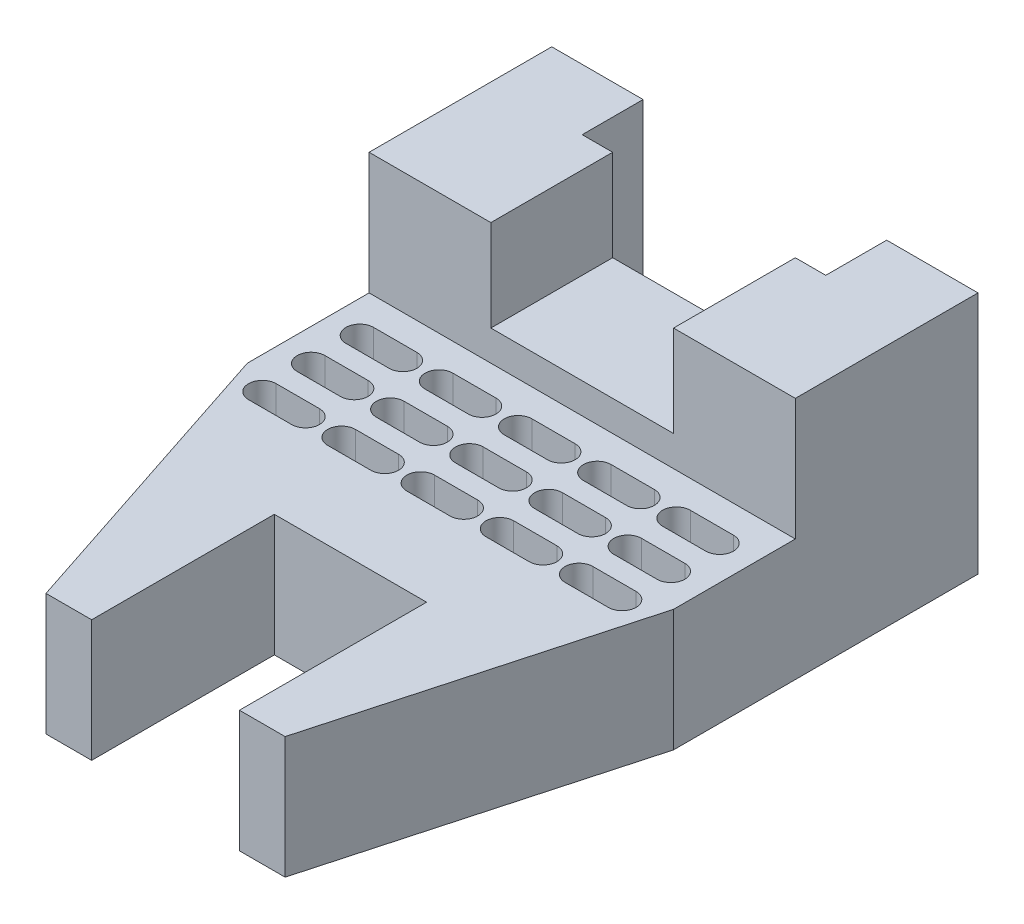
from build123d import *

# Parameters (mm, degrees)
SKETCH2_W           = 70
SKETCH2_H           = 40
BOSS_EXTRUDE1_DEPTH = 50
SKETCH3_W           = 40
SKETCH3_H           = 10
CUT_EXTRUDE1_DEPTH  = 40
SKETCH4_W           = 30
SKETCH4_H           = 40
CUT_EXTRUDE2_DEPTH  = 15
SKETCH5_W           = 70
SKETCH5_H           = 20
CUT_EXTRUDE3_DEPTH  = 20
BOSS_EXTRUDE2_DEPTH = 20
CUT_EXTRUDE4_DEPTH  = 124.693168769


with BuildPart() as part:
    # Sketch2 → Boss-Extrude1 (new body)
    with BuildSketch(Plane.XY):
        with Locations((35, 20)):
            Rectangle(SKETCH2_W, SKETCH2_H)
    extrude(amount=BOSS_EXTRUDE1_DEPTH)

    # Sketch3 → Cut-Extrude1 (cut)
    with BuildSketch(Plane(origin=(0, 40, 0), x_dir=(1, 0, 0), z_dir=(0, 1, 0))):
        with Locations((35, -5)):
            Rectangle(SKETCH3_W, SKETCH3_H)
    extrude(amount=-CUT_EXTRUDE1_DEPTH, mode=Mode.SUBTRACT)

    # Sketch4 → Cut-Extrude2 (cut)
    with BuildSketch(Plane(origin=(0, 40, 0), x_dir=(1, 0, 0), z_dir=(0, 1, 0))):
        with Locations((35, -30)):
            Rectangle(SKETCH4_W, SKETCH4_H)
    extrude(amount=-CUT_EXTRUDE2_DEPTH, mode=Mode.SUBTRACT)

    # Sketch5 → Cut-Extrude3 (cut)
    with BuildSketch(Plane(origin=(0, 40, 0), x_dir=(1, 0, 0), z_dir=(0, 1, 0))):
        with Locations((35, -40)):
            Rectangle(SKETCH5_W, SKETCH5_H)
    extrude(amount=-CUT_EXTRUDE3_DEPTH, mode=Mode.SUBTRACT)

    # Sketch6 → Boss-Extrude2 (add)
    with BuildSketch(Plane.XZ):
        Polygon((0, 50), (16.209807748, 99.268768354), (23.709807748, 99.268768354), (23.709807748, 69.268768354), (48.709807748, 69.268768354), (48.709807748, 100), (56.209807748, 100), (70, 50), align=None)
    extrude(amount=-BOSS_EXTRUDE2_DEPTH)

    # Sketch7 → Cut-Extrude4 (cut, through all)
    with BuildSketch(Plane(origin=(0, 20, 0), x_dir=(1, 0, 0), z_dir=(0, 1, 0))):
        with BuildLine():
            Line((5.284369051, -34.535416774), (12.378641305, -34.535416774))
            ThreePointArc((12.378641305, -34.535416774), (14.654162594, -36.810938063), (12.378641305, -39.086459352))
            Line((12.378641305, -39.086459352), (5.284369051, -39.086459352))
            ThreePointArc((5.284369051, -39.086459352), (3.008847762, -36.810938063), (5.284369051, -34.535416774))
        make_face()
        with BuildLine():
            Line((18.284369051, -34.535416774), (25.378641305, -34.535416774))
            ThreePointArc((25.378641305, -34.535416774), (27.654162594, -36.810938063), (25.378641305, -39.086459352))
            Line((25.378641305, -39.086459352), (18.284369051, -39.086459352))
            ThreePointArc((18.284369051, -39.086459352), (16.008847762, -36.810938063), (18.284369051, -34.535416774))
        make_face()
        with BuildLine():
            Line((31.284369051, -34.535416774), (38.378641305, -34.535416774))
            ThreePointArc((38.378641305, -34.535416774), (40.654162594, -36.810938063), (38.378641305, -39.086459352))
            Line((38.378641305, -39.086459352), (31.284369051, -39.086459352))
            ThreePointArc((31.284369051, -39.086459352), (29.008847762, -36.810938063), (31.284369051, -34.535416774))
        make_face()
        with BuildLine():
            Line((44.284369051, -34.535416774), (51.378641305, -34.535416774))
            ThreePointArc((51.378641305, -34.535416774), (53.654162594, -36.810938063), (51.378641305, -39.086459352))
            Line((51.378641305, -39.086459352), (44.284369051, -39.086459352))
            ThreePointArc((44.284369051, -39.086459352), (42.008847762, -36.810938063), (44.284369051, -34.535416774))
        make_face()
        with BuildLine():
            Line((57.284369051, -34.535416774), (64.378641305, -34.535416774))
            ThreePointArc((64.378641305, -34.535416774), (66.654162594, -36.810938063), (64.378641305, -39.086459352))
            Line((64.378641305, -39.086459352), (57.284369051, -39.086459352))
            ThreePointArc((57.284369051, -39.086459352), (55.008847762, -36.810938063), (57.284369051, -34.535416774))
        make_face()
        with BuildLine():
            Line((18.284369051, -42.535416774), (25.378641305, -42.535416774))
            ThreePointArc((25.378641305, -42.535416774), (27.654162594, -44.810938063), (25.378641305, -47.086459352))
            Line((25.378641305, -47.086459352), (18.284369051, -47.086459352))
            ThreePointArc((18.284369051, -47.086459352), (16.008847762, -44.810938063), (18.284369051, -42.535416774))
        make_face()
        with BuildLine():
            Line((31.284369051, -42.535416774), (38.378641305, -42.535416774))
            ThreePointArc((38.378641305, -42.535416774), (40.654162594, -44.810938063), (38.378641305, -47.086459352))
            Line((38.378641305, -47.086459352), (31.284369051, -47.086459352))
            ThreePointArc((31.284369051, -47.086459352), (29.008847762, -44.810938063), (31.284369051, -42.535416774))
        make_face()
        with BuildLine():
            Line((44.284369051, -42.535416774), (51.378641305, -42.535416774))
            ThreePointArc((51.378641305, -42.535416774), (53.654162594, -44.810938063), (51.378641305, -47.086459352))
            Line((51.378641305, -47.086459352), (44.284369051, -47.086459352))
            ThreePointArc((44.284369051, -47.086459352), (42.008847762, -44.810938063), (44.284369051, -42.535416774))
        make_face()
        with BuildLine():
            Line((57.284369051, -42.535416774), (64.378641305, -42.535416774))
            ThreePointArc((64.378641305, -42.535416774), (66.654162594, -44.810938063), (64.378641305, -47.086459352))
            Line((64.378641305, -47.086459352), (57.284369051, -47.086459352))
            ThreePointArc((57.284369051, -47.086459352), (55.008847762, -44.810938063), (57.284369051, -42.535416774))
        make_face()
        with BuildLine():
            Line((18.284369051, -50.535416774), (25.378641305, -50.535416774))
            ThreePointArc((25.378641305, -50.535416774), (27.654162594, -52.810938063), (25.378641305, -55.086459352))
            Line((25.378641305, -55.086459352), (18.284369051, -55.086459352))
            ThreePointArc((18.284369051, -55.086459352), (16.008847762, -52.810938063), (18.284369051, -50.535416774))
        make_face()
        with BuildLine():
            Line((31.284369051, -50.535416774), (38.378641305, -50.535416774))
            ThreePointArc((38.378641305, -50.535416774), (40.654162594, -52.810938063), (38.378641305, -55.086459352))
            Line((38.378641305, -55.086459352), (31.284369051, -55.086459352))
            ThreePointArc((31.284369051, -55.086459352), (29.008847762, -52.810938063), (31.284369051, -50.535416774))
        make_face()
        with BuildLine():
            Line((44.284369051, -50.535416774), (51.378641305, -50.535416774))
            ThreePointArc((51.378641305, -50.535416774), (53.654162594, -52.810938063), (51.378641305, -55.086459352))
            Line((51.378641305, -55.086459352), (44.284369051, -55.086459352))
            ThreePointArc((44.284369051, -55.086459352), (42.008847762, -52.810938063), (44.284369051, -50.535416774))
        make_face()
        with BuildLine():
            Line((57.284369051, -50.535416774), (64.378641305, -50.535416774))
            ThreePointArc((64.378641305, -50.535416774), (66.654162594, -52.810938063), (64.378641305, -55.086459352))
            Line((64.378641305, -55.086459352), (57.284369051, -55.086459352))
            ThreePointArc((57.284369051, -55.086459352), (55.008847762, -52.810938063), (57.284369051, -50.535416774))
        make_face()
        with BuildLine():
            Line((5.284369051, -42.535416774), (12.378641305, -42.535416774))
            ThreePointArc((12.378641305, -42.535416774), (14.654162594, -44.810938063), (12.378641305, -47.086459352))
            Line((12.378641305, -47.086459352), (5.284369051, -47.086459352))
            ThreePointArc((5.284369051, -47.086459352), (3.008847762, -44.810938063), (5.284369051, -42.535416774))
        make_face()
        with BuildLine():
            Line((5.284369051, -50.535416774), (12.378641305, -50.535416774))
            ThreePointArc((12.378641305, -50.535416774), (14.654162594, -52.810938063), (12.378641305, -55.086459352))
            Line((12.378641305, -55.086459352), (5.284369051, -55.086459352))
            ThreePointArc((5.284369051, -55.086459352), (3.008847762, -52.810938063), (5.284369051, -50.535416774))
        make_face()
    extrude(amount=-CUT_EXTRUDE4_DEPTH, mode=Mode.SUBTRACT)


solid = part.part
